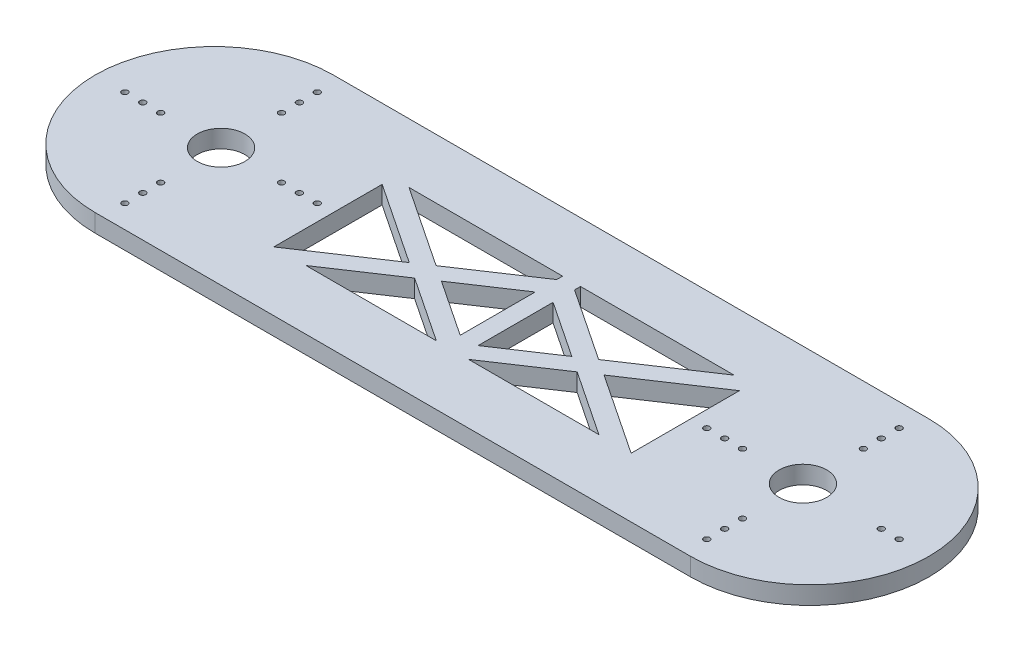
from build123d import *

# Parameters (mm, degrees)
SKETCH1_R           = 0.5
BOSS_EXTRUDE1_DEPTH = 3
BOSS_EXTRUDE2_DEPTH = 3


with BuildPart() as part:
    # Sketch1 → Boss-Extrude1 (new body)
    with BuildSketch(Plane(origin=(0, 0, 0), x_dir=(1, 0, 0), z_dir=(0, 1, 0))):
        with BuildLine():
            Line((50, 20), (-50, 20))
            ThreePointArc((-50, 20), (-70, 0), (-50, -20))
            Line((-50, -20), (50, -20))
            ThreePointArc((50, -20), (70, 0), (50, 20))
        make_face()
        with Locations(Location((-48.85, -16.15, 0), (0, 0, 270))):
            Circle(SKETCH1_R, mode=Mode.SUBTRACT)
        with BuildLine():
            ThreePointArc((-48.85, -12.65), (-48.35, -13.15), (-48.85, -13.65))
            ThreePointArc((-48.85, -13.65), (-49.35, -13.15), (-48.85, -12.65))
        make_face(mode=Mode.SUBTRACT)
        with BuildLine():
            ThreePointArc((-48.85, -9.65), (-48.35, -10.15), (-48.85, -10.65))
            ThreePointArc((-48.85, -10.65), (-49.35, -10.15), (-48.85, -9.65))
        make_face(mode=Mode.SUBTRACT)
        Polygon((-30, -10), (-30, 8.197224362), (-16.352081728, -0.901387819), align=None, mode=Mode.SUBTRACT)
        Polygon((-2.704163457, -10), (-24.591673087, -10), (-13.647918272, -2.704163457), align=None, mode=Mode.SUBTRACT)
        with Locations(Location((48.85, -16.15, 0), (0, 0, 270))):
            Circle(SKETCH1_R, mode=Mode.SUBTRACT)
        with BuildLine():
            ThreePointArc((48.85, -12.65), (49.35, -13.15), (48.85, -13.65))
            ThreePointArc((48.85, -13.65), (48.35, -13.15), (48.85, -12.65))
        make_face(mode=Mode.SUBTRACT)
        with BuildLine():
            ThreePointArc((48.85, -9.65), (49.35, -10.15), (48.85, -10.65))
            ThreePointArc((48.85, -10.65), (48.35, -10.15), (48.85, -9.65))
        make_face(mode=Mode.SUBTRACT)
        Polygon((24.591673087, -10), (2.704163457, -10), (13.647918272, -2.704163457), align=None, mode=Mode.SUBTRACT)
        Polygon((30, 8.197224362), (30, -10), (16.352081728, -0.901387819), align=None, mode=Mode.SUBTRACT)
        with Locations(Location((-65, 0, 0), (0, 0, 270))):
            Circle(SKETCH1_R, mode=Mode.SUBTRACT)
        with Locations(Location((-62, 0, 0), (0, 0, 270))):
            Circle(SKETCH1_R, mode=Mode.SUBTRACT)
        with Locations(Location((-59, 0, 0), (0, 0, 270))):
            Circle(SKETCH1_R, mode=Mode.SUBTRACT)
        with BuildLine():
            ThreePointArc((-44.85, 0), (-46.021572875, -2.828427125), (-48.85, -4))
            ThreePointArc((-48.85, -4), (-52.85, 0), (-48.85, 4))
            ThreePointArc((-48.85, 4), (-46.021572875, 2.828427125), (-44.85, 0))
        make_face(mode=Mode.SUBTRACT)
        with BuildLine():
            ThreePointArc((-38.2, 0), (-38.7, -0.5), (-39.2, 0))
            ThreePointArc((-39.2, 0), (-38.7, 0.5), (-38.2, 0))
        make_face(mode=Mode.SUBTRACT)
        with BuildLine():
            ThreePointArc((-35.2, 0), (-35.7, -0.5), (-36.2, 0))
            ThreePointArc((-36.2, 0), (-35.7, 0.5), (-35.2, 0))
        make_face(mode=Mode.SUBTRACT)
        with Locations(Location((-32.7, 0, 0), (0, 0, 270))):
            Circle(SKETCH1_R, mode=Mode.SUBTRACT)
        with BuildLine():
            ThreePointArc((-48.85, 10.65), (-48.35, 10.15), (-48.85, 9.65))
            ThreePointArc((-48.85, 9.65), (-49.35, 10.15), (-48.85, 10.65))
        make_face(mode=Mode.SUBTRACT)
        with BuildLine():
            ThreePointArc((-48.85, 13.65), (-48.35, 13.15), (-48.85, 12.65))
            ThreePointArc((-48.85, 12.65), (-49.35, 13.15), (-48.85, 13.65))
        make_face(mode=Mode.SUBTRACT)
        with Locations(Location((-48.85, 16.15, 0), (0, 0, 270))):
            Circle(SKETCH1_R, mode=Mode.SUBTRACT)
        Polygon((-27.295836543, 10), (27.295836543, 10), (13.647918272, 0.901387819), (1.5, 9), (1.5, 5.394448725), (10.943754815, -0.901387819), (1.5, -7.197224362), (1.5, -10), (-1.5, -10), (-1.5, -7.197224362), (-10.943754815, -0.901387819), (-1.5, 5.394448725), (-1.5, 9), (-13.647918272, 0.901387819), align=None, mode=Mode.SUBTRACT)
        with Locations(Location((32.7, 0, 0), (0, 0, 270))):
            Circle(SKETCH1_R, mode=Mode.SUBTRACT)
        with BuildLine():
            ThreePointArc((35.2, 0), (35.7, 0.5), (36.2, 0))
            ThreePointArc((36.2, 0), (35.7, -0.5), (35.2, 0))
        make_face(mode=Mode.SUBTRACT)
        with BuildLine():
            ThreePointArc((38.2, 0), (38.7, 0.5), (39.2, 0))
            ThreePointArc((39.2, 0), (38.7, -0.5), (38.2, 0))
        make_face(mode=Mode.SUBTRACT)
        with BuildLine():
            ThreePointArc((48.85, 4), (52.85, 0), (48.85, -4))
            ThreePointArc((48.85, -4), (46.021572875, -2.828427125), (44.85, 0))
            ThreePointArc((44.85, 0), (46.021572875, 2.828427125), (48.85, 4))
        make_face(mode=Mode.SUBTRACT)
        with Locations(Location((62, 0, 0), (0, 0, 270))):
            Circle(SKETCH1_R, mode=Mode.SUBTRACT)
        with Locations(Location((65, 0, 0), (0, 0, 270))):
            Circle(SKETCH1_R, mode=Mode.SUBTRACT)
        with BuildLine():
            ThreePointArc((48.85, 10.65), (49.35, 10.15), (48.85, 9.65))
            ThreePointArc((48.85, 9.65), (48.35, 10.15), (48.85, 10.65))
        make_face(mode=Mode.SUBTRACT)
        with BuildLine():
            ThreePointArc((48.85, 13.65), (49.35, 13.15), (48.85, 12.65))
            ThreePointArc((48.85, 12.65), (48.35, 13.15), (48.85, 13.65))
        make_face(mode=Mode.SUBTRACT)
        with Locations(Location((48.85, 16.15, 0), (0, 0, 270))):
            Circle(SKETCH1_R, mode=Mode.SUBTRACT)
    extrude(amount=BOSS_EXTRUDE1_DEPTH)

    # Sketch1<3> → Boss-Extrude2 (add)
    with BuildSketch(Plane(origin=(0, 0, 0), x_dir=(1, 0, 0), z_dir=(0, 1, 0))):
        Polygon((0, -10), (0, 10), (-1.5, 9), (-1.5, 5.394448725), (-1.5, -7.197224362), (-1.5, -10), align=None)
        Polygon((1.5, 9), (0, 10), (0, -10), (1.5, -10), (1.5, -7.197224362), (1.5, 5.394448725), align=None)
        Polygon((1.5, 10), (0, 10), (1.5, 9), align=None)
        Polygon((-1.5, 9), (0, 10), (-1.5, 10), align=None)
    extrude(amount=BOSS_EXTRUDE2_DEPTH)


solid = part.part
